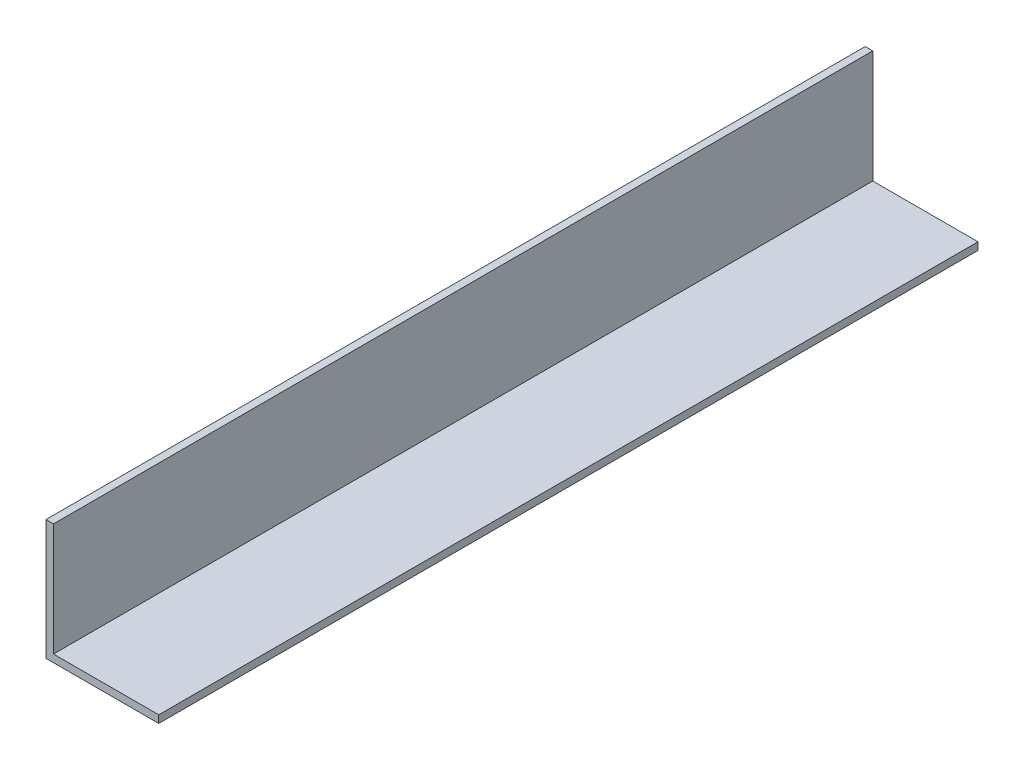
from build123d import *

# Parameters (mm, degrees)
BOSS_EXTRUDE1_DEPTH = 218


with BuildPart() as part:
    # Sketch1 → Boss-Extrude1 (new body)
    with BuildSketch(Plane.XY):
        Polygon((0, 0), (0, 32), (2, 32), (2, 2), (30, 2), (30, 0), align=None)
    extrude(amount=BOSS_EXTRUDE1_DEPTH)


solid = part.part
